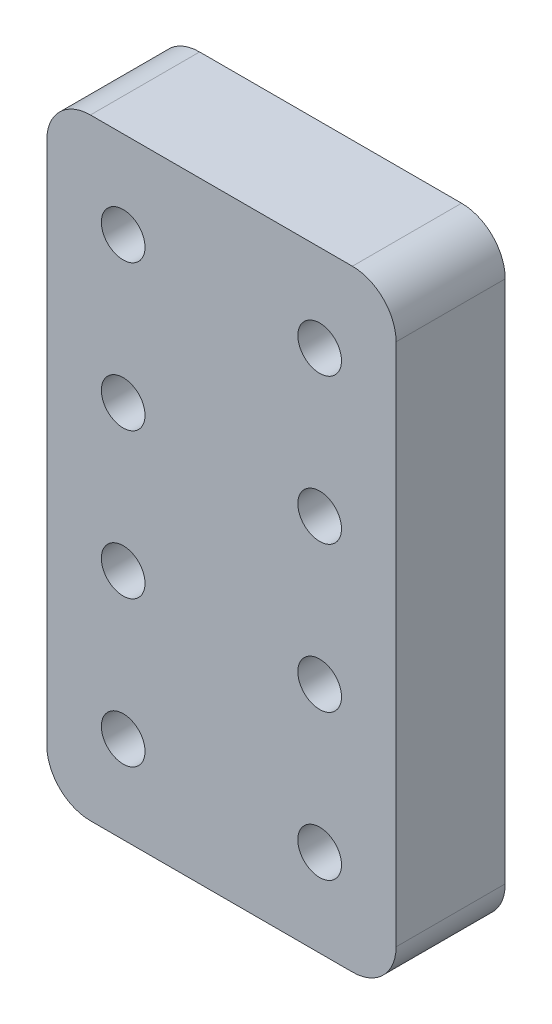
from build123d import *

# Parameters (mm, degrees)
SKETCH_1_R      = 2
EXTRUDE_1_DEPTH = 10


with BuildPart() as part:
    # 草图1 → 凸台-拉伸1 (new body)
    with BuildSketch(Plane.XY):
        with BuildLine():
            Line((12, 28), (-12, 28))
            ThreePointArc((-12, 28), (-14.828427125, 26.828427125), (-16, 24))
            Line((-16, 24), (-16, -24))
            ThreePointArc((-16, -24), (-14.828427125, -26.828427125), (-12, -28))
            Line((-12, -28), (12, -28))
            ThreePointArc((12, -28), (14.828427125, -26.828427125), (16, -24))
            Line((16, -24), (16, 24))
            ThreePointArc((16, 24), (14.828427125, 26.828427125), (12, 28))
        make_face()
        with Locations((9, 20)):
            Circle(SKETCH_1_R, mode=Mode.SUBTRACT)
        with Locations((9, 6.666666667)):
            Circle(SKETCH_1_R, mode=Mode.SUBTRACT)
        with Locations((9, -6.666666667)):
            Circle(SKETCH_1_R, mode=Mode.SUBTRACT)
        with Locations((9, -20)):
            Circle(SKETCH_1_R, mode=Mode.SUBTRACT)
        with Locations(Location((-9, -20, 0), (0, 0, 180))):
            Circle(SKETCH_1_R, mode=Mode.SUBTRACT)
        with Locations(Location((-9, -6.666666667, 0), (0, 0, 180))):
            Circle(SKETCH_1_R, mode=Mode.SUBTRACT)
        with Locations(Location((-9, 6.666666667, 0), (0, 0, 180))):
            Circle(SKETCH_1_R, mode=Mode.SUBTRACT)
        with Locations(Location((-9, 20, 0), (0, 0, 180))):
            Circle(SKETCH_1_R, mode=Mode.SUBTRACT)
    extrude(amount=EXTRUDE_1_DEPTH)


solid = part.part
